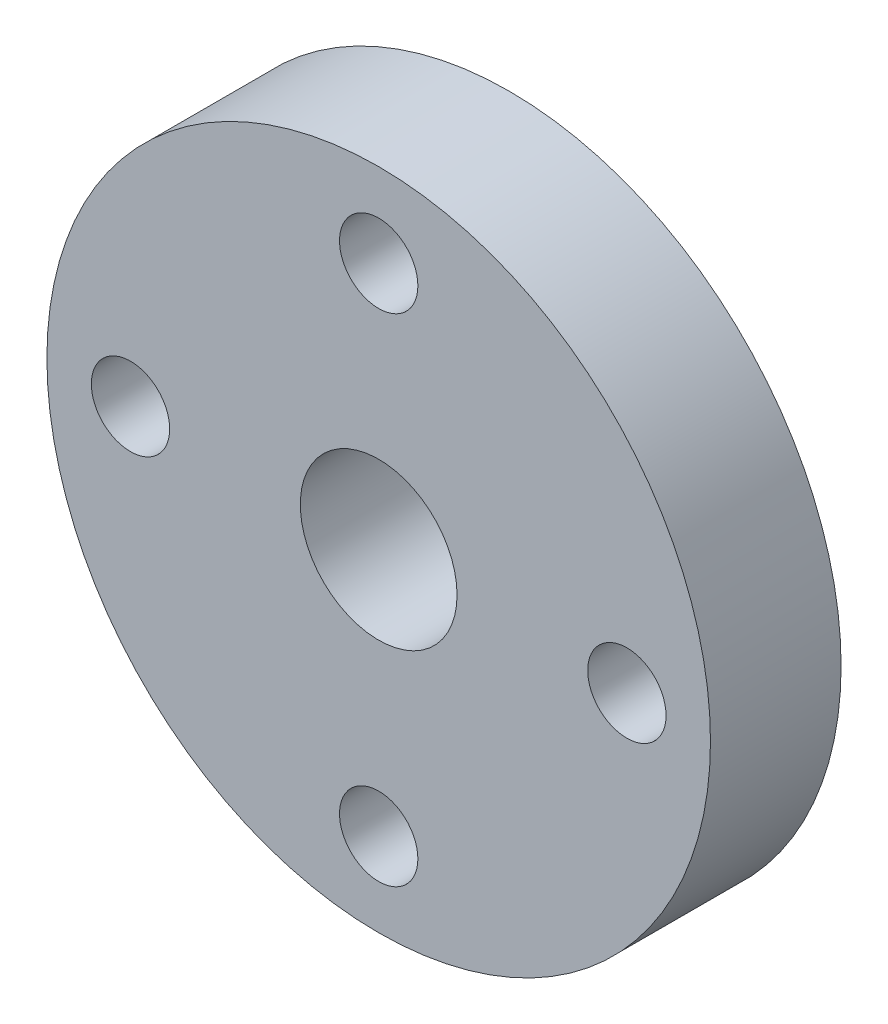
from build123d import *

# Parameters (mm, degrees)
SKETCH1_R           = 6
SKETCH1_R_2         = 3
BOSS_EXTRUDE1_DEPTH = 4.2
SKETCH2_R           = 12.7
SKETCH2_R_2         = 3
BOSS_EXTRUDE2_DEPTH = 5
SKETCH3_R           = 1.5
CUT_EXTRUDE1_DEPTH  = 5


with BuildPart() as part:
    # Sketch1 → Boss-Extrude1 (new body)
    with BuildSketch(Plane.XY):
        Circle(SKETCH1_R)
        Circle(SKETCH1_R_2, mode=Mode.SUBTRACT)
    extrude(amount=BOSS_EXTRUDE1_DEPTH)

    # Sketch2 → Boss-Extrude2 (add)
    with BuildSketch(Plane.XY.offset(4.2)):
        Circle(SKETCH2_R)
        Circle(SKETCH2_R_2, mode=Mode.SUBTRACT)
    extrude(amount=BOSS_EXTRUDE2_DEPTH)

    # Sketch3 → Cut-Extrude1 (cut)
    with BuildSketch(Plane.XY.offset(9.2)):
        with Locations((0, 9.49515399)):
            Circle(SKETCH3_R)
        with Locations((0, -9.5)):
            Circle(SKETCH3_R)
        with Locations((9.5, 0)):
            Circle(SKETCH3_R)
        with Locations((-9.5, 0)):
            Circle(SKETCH3_R)
    extrude(amount=-CUT_EXTRUDE1_DEPTH, mode=Mode.SUBTRACT)


solid = part.part
